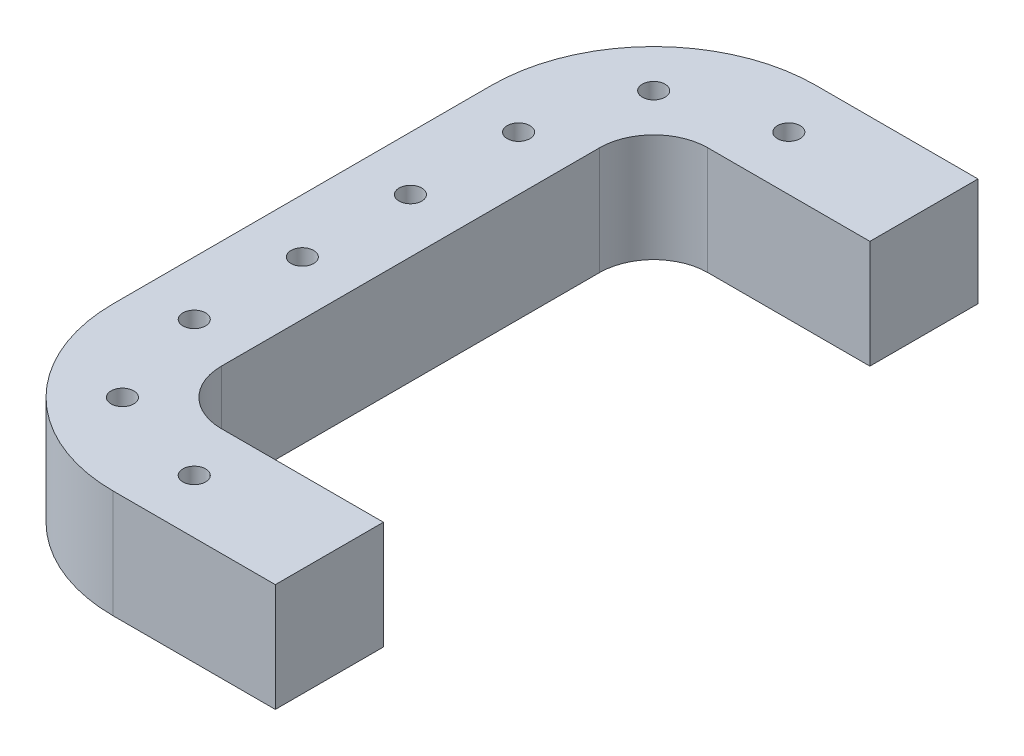
from build123d import *

# Parameters (mm, degrees)
BOSS_EXTRUDE1_DEPTH = 10
SKETCH3_W           = 20
SKETCH3_H           = 5
BOSS_EXTRUDE2_DEPTH = 20
SKETCH2_R           = 2.1
CUT_EXTRUDE1_DEPTH  = 81.622577483


with BuildPart() as part:
    # Sketch1 → Boss-Extrude1 (new, symmetric)
    with BuildSketch(Plane(origin=(0, 0, 0), x_dir=(1, 0, 0), z_dir=(0, 1, 0))):
        with BuildLine():
            Line((10, 0), (10, 30))
            ThreePointArc((10, 30), (12.928932188, 37.071067812), (20, 40))
            Line((20, 40), (50, 40))
            Line((50, 40), (50, 60))
            Line((50, 60), (20, 60))
            ThreePointArc((20, 60), (-1.213203436, 51.213203436), (-10, 30))
            Line((-10, 30), (-10, 0))
            Line((-10, 0), (10, 0))
        make_face()
    extrude(amount=BOSS_EXTRUDE1_DEPTH, both=True)

    # Sketch3 → Boss-Extrude2 (add)
    with BuildSketch(Plane(origin=(0, 10, 0), x_dir=(1, 0, 0), z_dir=(0, 1, 0))):
        with Locations((0, -2.5)):
            Rectangle(SKETCH3_W, SKETCH3_H)
    extrude(amount=-BOSS_EXTRUDE2_DEPTH)

    # Sketch2 → Cut-Extrude1 (cut, through all)
    with BuildSketch(Plane(origin=(0, 10, 0), x_dir=(1, 0, 0), z_dir=(0, 1, 0))):
        with Locations(Location((5.857864376, 44.142135624, 0), (0, 0, 270))):
            Circle(SKETCH2_R)
        with Locations(Location((0, 25, 0), (0, 0, 270))):
            Circle(SKETCH2_R)
        with Locations(Location((25, 50, 0), (0, 0, 90))):
            Circle(SKETCH2_R)
        with Locations(Location((0, 5, 0), (0, 0, 270))):
            Circle(SKETCH2_R)
    extrude(amount=-CUT_EXTRUDE1_DEPTH, mode=Mode.SUBTRACT)

    # Mirror1: part across plane


with BuildPart() as part_1:
    add(part.part)
    add(part.part.mirror(Plane(origin=(10, -30.615528128, 5), x_dir=(1, 0, 0), z_dir=(0, 0, 1))))


solid = part_1.part
